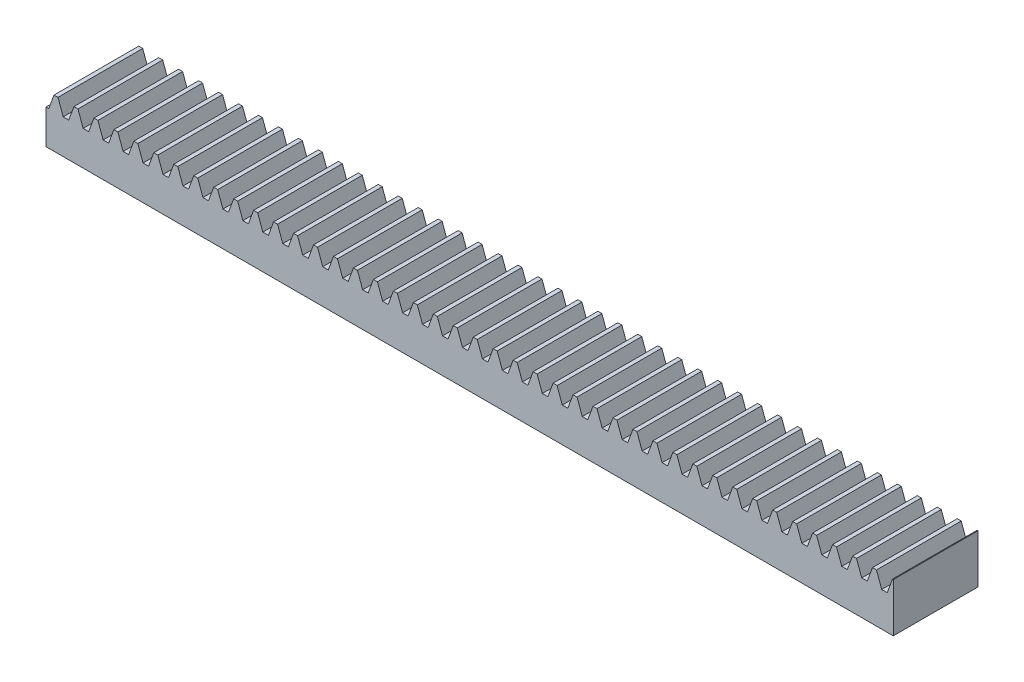
from build123d import *

# Parameters (mm, degrees)
BLANKSKE_W        = 200
BLANKSKE_H        = 11.5
BLANK_DEPTH       = 20
TOOTHCUTSIM_DEPTH = 202.3262278
TEETHCUTS_COUNT   = 43
TEETHCUTS_PITCH   = 4.712388975


with BuildPart() as part:
    # BlankSke → Blank (new body)
    with BuildSketch(Plane.XY):
        with Locations((100, 5.75)):
            Rectangle(BLANKSKE_W, BLANKSKE_H)
    extrude(amount=-BLANK_DEPTH)

    # TooCutSkeSim → ToothCutSim (cut, through all)
    with BuildSketch(Plane.XY):
        Polygon((0.654653055, 8.125), (-0.654653055, 8.125), (-1.892297439, 11.5254), (1.892297439, 11.5254), align=None)
    toothcutsim = extrude(amount=-TOOTHCUTSIM_DEPTH, mode=Mode.SUBTRACT)

    # TeethCuts: ToothCutSim ×43
    with Locations(*[(i * TEETHCUTS_PITCH, 0, 0) for i in range(1, TEETHCUTS_COUNT)]):
        add(toothcutsim, mode=Mode.SUBTRACT)


solid = part.part
